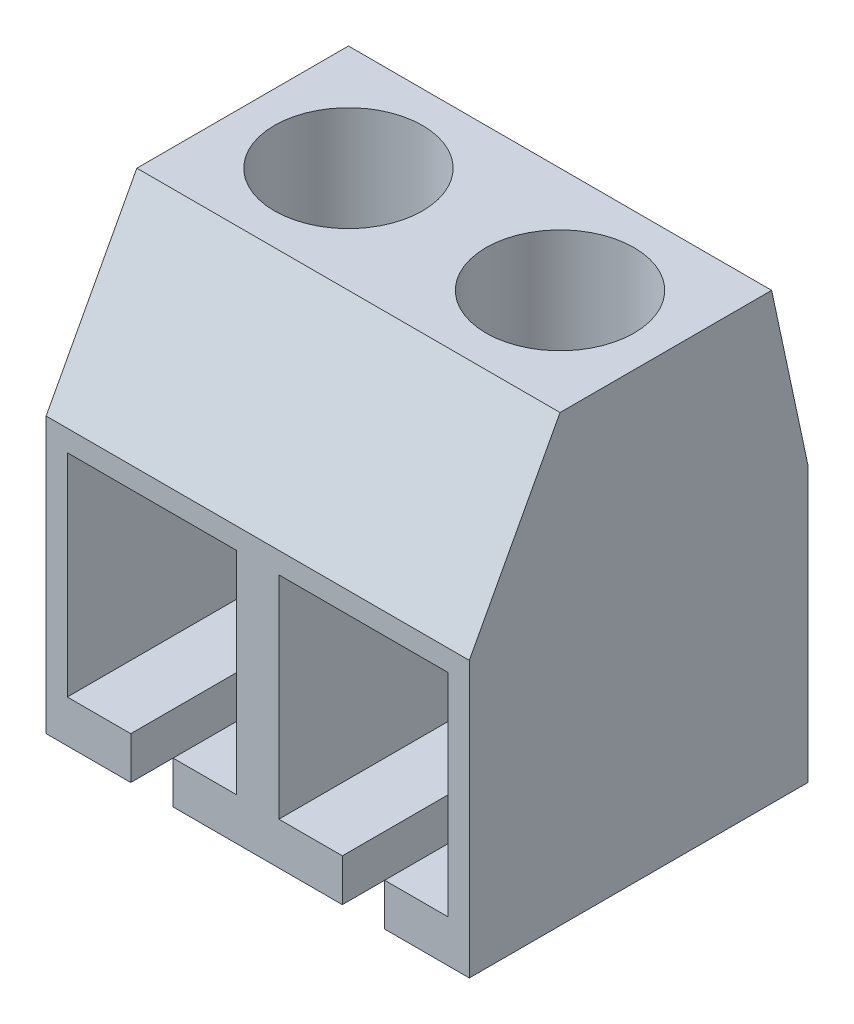
from build123d import *

# Parameters (mm, degrees)
Y_KSEKLIK_EKSTR_ZYON1_DEPTH      = 5
Y_KSEKLIK_EKSTR_ZYON1_DEPTH_BACK = 5
KES_EKSTR_ZYON1_DEPTH            = 10
IZIM3_R                          = 1.75
KES_EKSTR_ZYON2_DEPTH            = 7


with BuildPart() as part:
    # Çizim1 → Yükseklik-Ekstrüzyon1 (new, two sides: drawn at the far end of the back side and taken through both)
    with BuildSketch(Plane(origin=(0, 0, 0), x_dir=(0, 0, -1), z_dir=(1, 0, 0)).offset(-Y_KSEKLIK_EKSTR_ZYON1_DEPTH_BACK)):
        Polygon((-1.856187291, 5), (3.143812709, 5), (4, 1), (4, -5.5), (-4, -5.5), (-4, 1), align=None)
    extrude(amount=Y_KSEKLIK_EKSTR_ZYON1_DEPTH + Y_KSEKLIK_EKSTR_ZYON1_DEPTH_BACK)

    # Çizim2 → Kes-Ekstrüzyon1 (cut)
    with BuildSketch(Plane(origin=(0, 0, -4), x_dir=(-1, 0, 0), z_dir=(0, 0, -1))):
        Polygon((-3, -4.5), (-3, -5.5), (-2, -5.5), (-2, -4.5), (-0.5, -4.5), (-0.5, 0.5), (-4.5, 0.5), (-4.5, -4.5), align=None)
        Polygon((2, -4.5), (2, -5.5), (3, -5.5), (3, -4.5), (4.5, -4.5), (4.5, 0.5), (0.5, 0.5), (0.5, -4.5), align=None)
    extrude(amount=-KES_EKSTR_ZYON1_DEPTH, mode=Mode.SUBTRACT)

    # Çizim3 → Kes-Ekstrüzyon2 (cut)
    with BuildSketch(Plane(origin=(0, 5, 0), x_dir=(1, 0, 0), z_dir=(0, 1, 0))):
        with Locations((-2.5, 0.643812709)):
            Circle(IZIM3_R)
        with Locations((2.5, 0.643812709)):
            Circle(IZIM3_R)
    extrude(amount=-KES_EKSTR_ZYON2_DEPTH, mode=Mode.SUBTRACT)


solid = part.part
